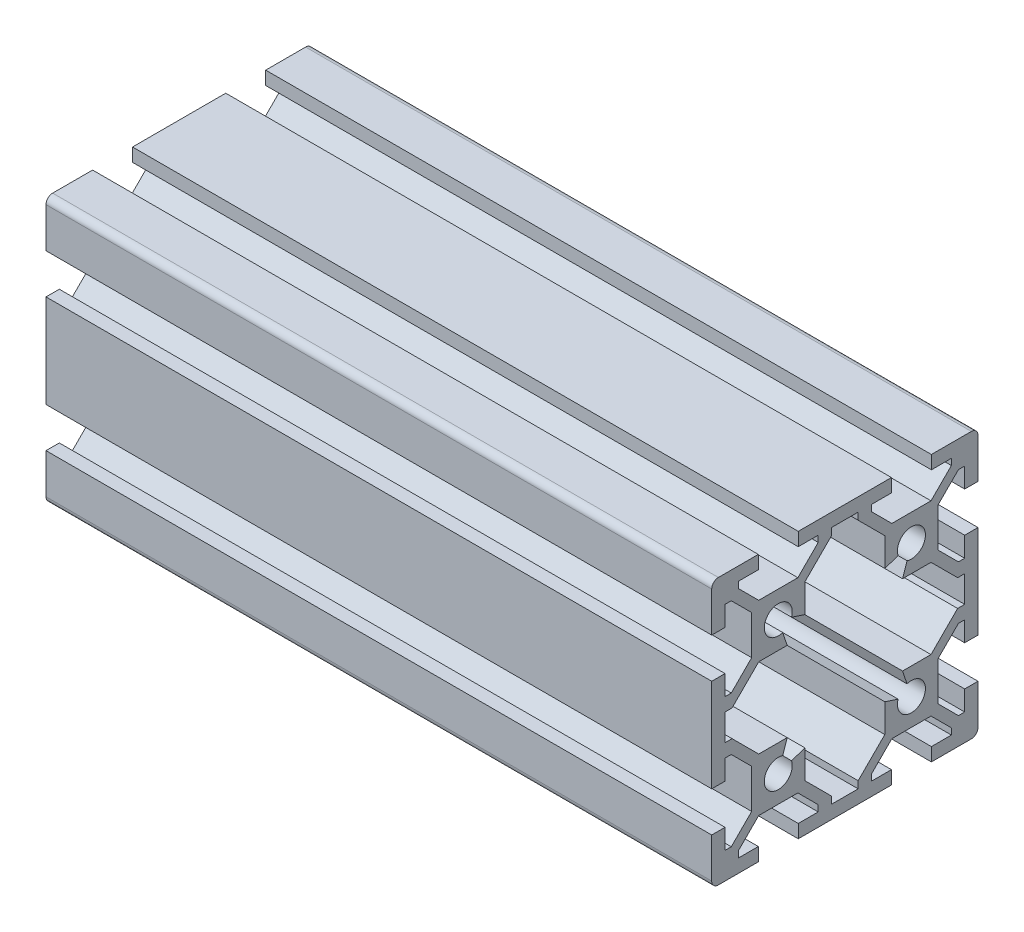
from build123d import *

# Parameters (mm, degrees)
BOSS_EXTRUDE1_DEPTH = 100


with BuildPart() as part:
    # Sketch1 → Boss-Extrude1 (new body)
    with BuildSketch(Plane(origin=(0, 0, 0), x_dir=(0, 0, -1), z_dir=(1, 0, 0))):
        with BuildLine():
            Line((-20, 19), (-20, 13))
            Line((-20, 13), (-18, 13))
            Line((-18, 13), (-18, 16))
            Line((-18, 16), (-17.060660172, 16))
            Line((-17.060660172, 16), (-14, 12.939339828))
            Line((-14, 12.939339828), (-14, 7.060660172))
            Line((-14, 7.060660172), (-17.060660172, 4))
            Line((-17.060660172, 4), (-18, 4))
            Line((-18, 4), (-18, 7))
            Line((-18, 7), (-20, 7))
            Line((-20, 7), (-20, -7))
            Line((-20, -7), (-18, -7))
            Line((-18, -7), (-18, -4))
            Line((-18, -4), (-17.060660172, -4))
            Line((-17.060660172, -4), (-14, -7.060660172))
            Line((-14, -7.060660172), (-14, -12.939339828))
            Line((-14, -12.939339828), (-17.060660172, -16))
            Line((-17.060660172, -16), (-18, -16))
            Line((-18, -16), (-18, -13))
            Line((-18, -13), (-20, -13))
            Line((-20, -13), (-20, -19))
            ThreePointArc((-20, -19), (-19.707106781, -19.707106781), (-19, -20))
            Line((-19, -20), (-13, -20))
            Line((-13, -20), (-13, -18))
            Line((-13, -18), (-16, -18))
            Line((-16, -18), (-16, -17.060660172))
            Line((-16, -17.060660172), (-12.939339828, -14))
            Line((-12.939339828, -14), (-7.060660172, -14))
            Line((-7.060660172, -14), (-4, -17.060660172))
            Line((-4, -17.060660172), (-4, -18))
            Line((-4, -18), (-7, -18))
            Line((-7, -18), (-7, -20))
            Line((-7, -20), (7, -20))
            Line((7, -20), (7, -18))
            Line((7, -18), (4, -18))
            Line((4, -18), (4, -17.060660172))
            Line((4, -17.060660172), (7.060660172, -14))
            Line((7.060660172, -14), (12.939339828, -14))
            Line((12.939339828, -14), (16, -17.060660172))
            Line((16, -17.060660172), (16, -18))
            Line((16, -18), (13, -18))
            Line((13, -18), (13, -20))
            Line((13, -20), (19, -20))
            ThreePointArc((19, -20), (19.707106781, -19.707106781), (20, -19))
            Line((20, -19), (20, -13))
            Line((20, -13), (18, -13))
            Line((18, -13), (18, -16))
            Line((18, -16), (17.060660172, -16))
            Line((17.060660172, -16), (14, -12.939339828))
            Line((14, -12.939339828), (14, -7.060660172))
            Line((14, -7.060660172), (17.060660172, -4))
            Line((17.060660172, -4), (18, -4))
            Line((18, -4), (18, -7))
            Line((18, -7), (20, -7))
            Line((20, -7), (20, 7))
            Line((20, 7), (18, 7))
            Line((18, 7), (18, 4))
            Line((18, 4), (17.060660172, 4))
            Line((17.060660172, 4), (14, 7.060660172))
            Line((14, 7.060660172), (14, 12.939339828))
            Line((14, 12.939339828), (17.060660172, 16))
            Line((17.060660172, 16), (18, 16))
            Line((18, 16), (18, 13))
            Line((18, 13), (20, 13))
            Line((20, 13), (20, 19))
            ThreePointArc((20, 19), (19.707106781, 19.707106781), (19, 20))
            Line((19, 20), (13, 20))
            Line((13, 20), (13, 18))
            Line((13, 18), (16, 18))
            Line((16, 18), (16, 17.060660172))
            Line((16, 17.060660172), (12.939339828, 14))
            Line((12.939339828, 14), (7.060660172, 14))
            Line((7.060660172, 14), (4, 17.060660172))
            Line((4, 17.060660172), (4, 18))
            Line((4, 18), (7, 18))
            Line((7, 18), (7, 20))
            Line((7, 20), (-7, 20))
            Line((-7, 20), (-7, 18))
            Line((-7, 18), (-4, 18))
            Line((-4, 18), (-4, 17.060660172))
            Line((-4, 17.060660172), (-7.060660172, 14))
            Line((-7.060660172, 14), (-12.939339828, 14))
            Line((-12.939339828, 14), (-16, 17.060660172))
            Line((-16, 17.060660172), (-16, 18))
            Line((-16, 18), (-13, 18))
            Line((-13, 18), (-13, 20))
            Line((-13, 20), (-19, 20))
            ThreePointArc((-19, 20), (-19.707106781, 19.707106781), (-20, 19))
        make_face()
        with BuildLine():
            Line((-16.939339828, 2), (-18, 2))
            Line((-18, 2), (-18, -2))
            Line((-18, -2), (-16.939339828, -2))
            Line((-16.939339828, -2), (-12.939339828, -6))
            Line((-12.939339828, -6), (-8.666662697, -6))
            Line((-8.666662697, -6), (-9.335919912, -8.007765667))
            ThreePointArc((-9.335919912, -8.007765667), (-11.48492424, -11.48492424), (-8.007765667, -9.335919912))
            Line((-8.007765667, -9.335919912), (-6, -8.666662697))
            Line((-6, -8.666662697), (-6, -12.939339828))
            Line((-6, -12.939339828), (-2, -16.939339828))
            Line((-2, -16.939339828), (-2, -18))
            Line((-2, -18), (2, -18))
            Line((2, -18), (2, -16.939339828))
            Line((2, -16.939339828), (6, -12.939339828))
            Line((6, -12.939339828), (6, -8.666662697))
            Line((6, -8.666662697), (8.007765667, -9.335919912))
            ThreePointArc((8.007765667, -9.335919912), (11.48492424, -11.48492424), (9.335919912, -8.007765667))
            Line((9.335919912, -8.007765667), (8.666662697, -6))
            Line((8.666662697, -6), (12.939339828, -6))
            Line((12.939339828, -6), (16.939339828, -2))
            Line((16.939339828, -2), (18, -2))
            Line((18, -2), (18, 2))
            Line((18, 2), (16.939339828, 2))
            Line((16.939339828, 2), (12.939339828, 6))
            Line((12.939339828, 6), (8.666662697, 6))
            Line((8.666662697, 6), (9.335919912, 8.007765667))
            ThreePointArc((9.335919912, 8.007765667), (11.48492424, 11.48492424), (8.007765667, 9.335919912))
            Line((8.007765667, 9.335919912), (6, 8.666662697))
            Line((6, 8.666662697), (6, 12.939339828))
            Line((6, 12.939339828), (2, 16.939339828))
            Line((2, 16.939339828), (2, 18))
            Line((2, 18), (-2, 18))
            Line((-2, 18), (-2, 16.939339828))
            Line((-2, 16.939339828), (-6, 12.939339828))
            Line((-6, 12.939339828), (-6, 8.666662697))
            Line((-6, 8.666662697), (-8.007765667, 9.335919912))
            ThreePointArc((-8.007765667, 9.335919912), (-11.48492424, 11.48492424), (-9.335919912, 8.007765667))
            Line((-9.335919912, 8.007765667), (-8.666662697, 6))
            Line((-8.666662697, 6), (-12.939339828, 6))
            Line((-12.939339828, 6), (-16.939339828, 2))
        make_face(mode=Mode.SUBTRACT)
    extrude(amount=BOSS_EXTRUDE1_DEPTH)


solid = part.part
